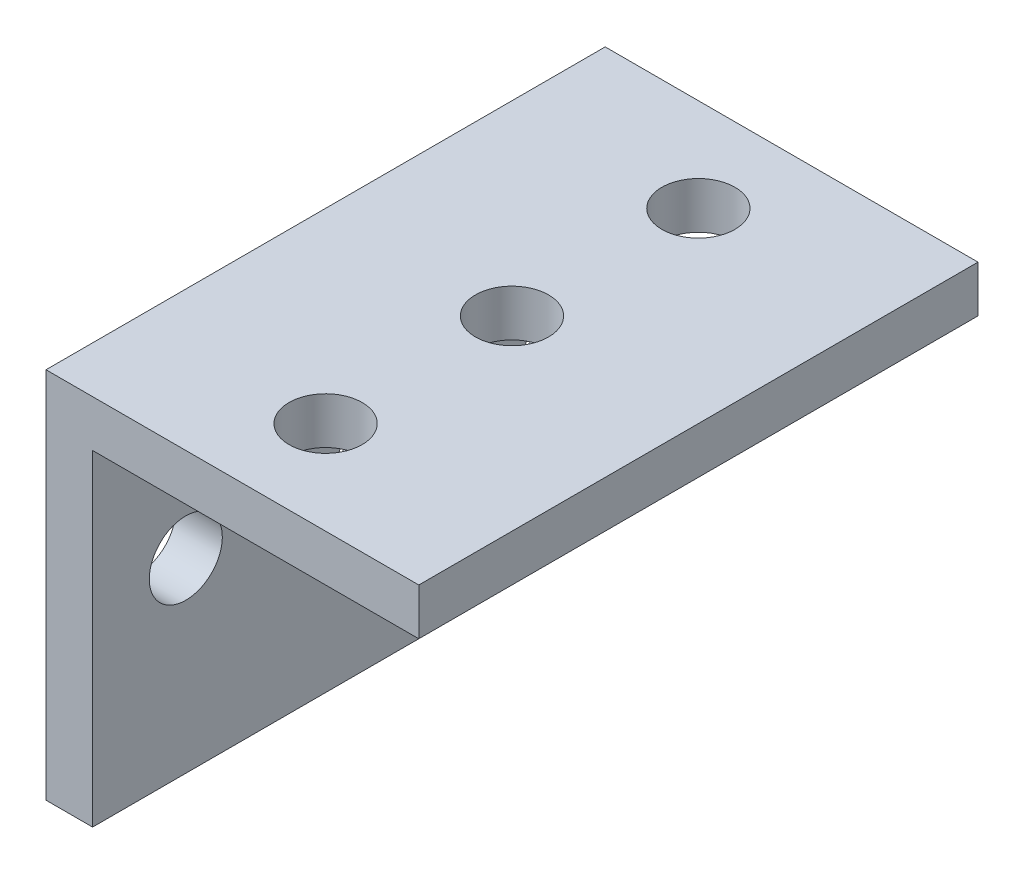
from build123d import *

# Parameters (mm, degrees)
BOSS_EXTRUDE1_DEPTH = 38.1
SKETCH5_R           = 2.4892
CUT_EXTRUDE1_DEPTH  = 51.899122045
SKETCH6_R           = 2.4892
CUT_EXTRUDE2_DEPTH  = 51.899122045


with BuildPart() as part:
    # Sketch2 → Boss-Extrude1 (new body)
    with BuildSketch(Plane.XY):
        Polygon((0, 0), (0, -25.4), (3.175, -25.4), (3.175, -3.175), (25.4, -3.175), (25.4, 0), align=None)
    extrude(amount=BOSS_EXTRUDE1_DEPTH)

    # Sketch5 → Cut-Extrude1 (cut, through all)
    with BuildSketch(Plane(origin=(3.175, 0, 0), x_dir=(0, 0, -1), z_dir=(1, 0, 0))):
        with Locations(Location((-6.35, -12.7, 0), (0, 0, 90))):
            Circle(SKETCH5_R)
        with Locations(Location((-19.05, -12.7, 0), (0, 0, 90))):
            Circle(SKETCH5_R)
        with Locations(Location((-31.75, -12.7, 0), (0, 0, 90))):
            Circle(SKETCH5_R)
        with Locations((-44.45, -12.7)):
            Circle(SKETCH5_R)
    extrude(amount=-CUT_EXTRUDE1_DEPTH, mode=Mode.SUBTRACT)

    # Sketch6 → Cut-Extrude2 (cut, through all)
    with BuildSketch(Plane.XZ.offset(3.175)):
        with Locations((12.7, 6.35)):
            Circle(SKETCH6_R)
        with Locations((12.7, 19.05)):
            Circle(SKETCH6_R)
        with Locations((12.7, 31.75)):
            Circle(SKETCH6_R)
        with Locations((12.7, 44.45)):
            Circle(SKETCH6_R)
    extrude(amount=-CUT_EXTRUDE2_DEPTH, mode=Mode.SUBTRACT)


solid = part.part
